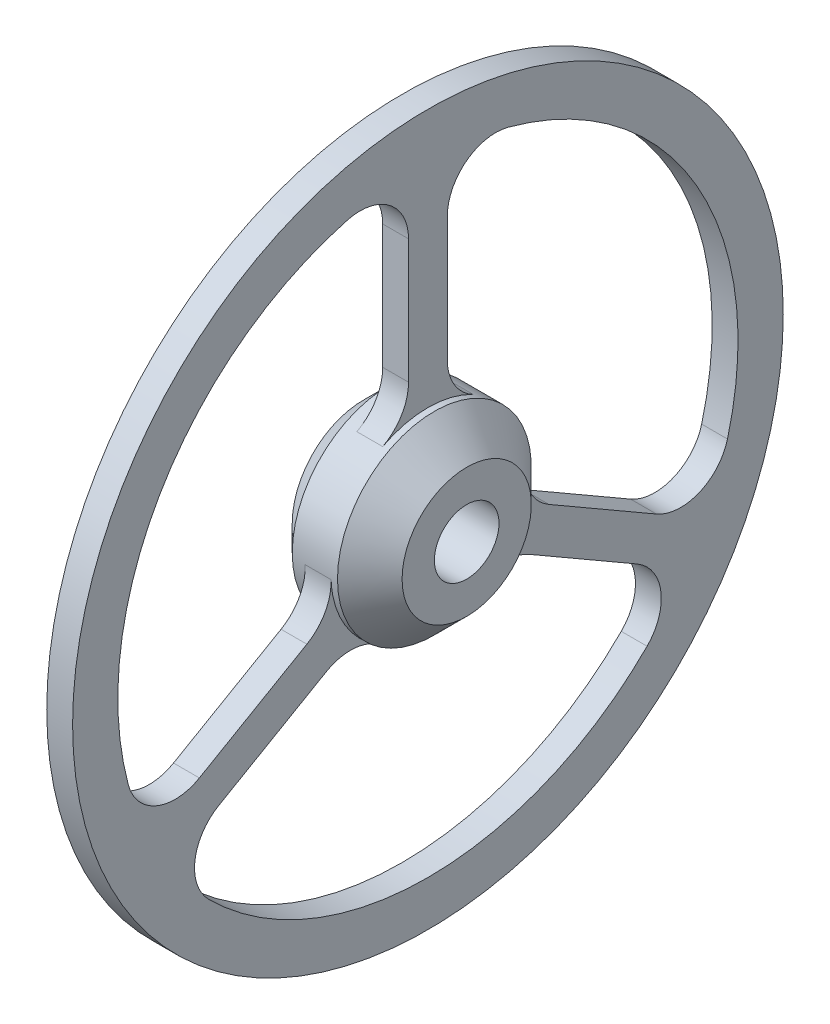
from build123d import *
from build123d.topology import SkipClean

# Parameters (mm, degrees)
SKETCH_1_R          = 55
EXTRUDE_1_DEPTH     = 4
SKETCH_4_R          = 15
SKETCH_3_R          = 15
SKETCH_7_R          = 15
SKETCH_6_R          = 15
SKETCH_9_R          = 5
CUT_EXTRUDE_1_DEPTH = 24
CHAMFER_1_SIZE      = 5
CHAMFER_2_SIZE      = 4


with BuildPart() as part:
    # 草图1 → 凸台-拉伸1 (new body)
    with BuildSketch(Plane(origin=(0, 0, 0), x_dir=(0, 0, -1), z_dir=(1, 0, 0))):
        Circle(SKETCH_1_R)
        with BuildLine():
            Line((-3, 39.115214431), (-3, 19.899748742))
            ThreePointArc((-3, 19.899748742), (-4.077383711, 16.026765396), (-7, 13.266499161))
            ThreePointArc((-7, 13.266499161), (-12.990381057, 7.5), (-14.989125293, -0.571071754))
            ThreePointArc((-14.989125293, -0.571071754), (-15.918277829, -4.482264824), (-18.73368794, -7.35179816))
            Line((-18.73368794, -7.35179816), (-35.374769372, -16.959531004))
            ThreePointArc((-35.374769372, -16.959531004), (-41.996474081, -17.39278273), (-46.370097033, -12.402181305))
            ThreePointArc((-46.370097033, -12.402181305), (-41.569219382, 24), (-12.444444444, 46.358772659))
            ThreePointArc((-12.444444444, 46.358772659), (-5.935645354, 45.066404788), (-3, 39.115214431))
        make_face(mode=Mode.SUBTRACT)
        with BuildLine():
            Line((3, 39.115214431), (3, 19.899748742))
            ThreePointArc((3, 19.899748742), (4.077383711, 16.026765396), (7, 13.266499161))
            ThreePointArc((7, 13.266499161), (12.990381057, 7.5), (14.989125293, -0.571071754))
            ThreePointArc((14.989125293, -0.571071754), (15.918277829, -4.482264824), (18.73368794, -7.35179816))
            Line((18.73368794, -7.35179816), (35.374769372, -16.959531004))
            ThreePointArc((35.374769372, -16.959531004), (41.996474081, -17.39278273), (46.370097033, -12.402181305))
            ThreePointArc((46.370097033, -12.402181305), (41.569219382, 24), (12.444444444, 46.358772659))
            ThreePointArc((12.444444444, 46.358772659), (5.935645354, 45.066404788), (3, 39.115214431))
        make_face(mode=Mode.SUBTRACT)
        with BuildLine():
            Line((32.374769372, -22.155683427), (15.73368794, -12.547950582))
            ThreePointArc((15.73368794, -12.547950582), (11.840894118, -11.544500572), (7.989125293, -12.695427407))
            ThreePointArc((7.989125293, -12.695427407), (0, -15), (-7.989125293, -12.695427407))
            ThreePointArc((-7.989125293, -12.695427407), (-11.840894118, -11.544500572), (-15.73368794, -12.547950582))
            Line((-15.73368794, -12.547950582), (-32.374769372, -22.155683427))
            ThreePointArc((-32.374769372, -22.155683427), (-36.060828727, -27.673622059), (-33.925652589, -33.956591354))
            ThreePointArc((-33.925652589, -33.956591354), (0, -48), (33.925652589, -33.956591354))
            ThreePointArc((33.925652589, -33.956591354), (36.060828727, -27.673622059), (32.374769372, -22.155683427))
        make_face(mode=Mode.SUBTRACT)
    extrude(amount=EXTRUDE_1_DEPTH)

    # 草图4 → 放样1 section 0
    with BuildSketch(Plane.ZY):
        Circle(SKETCH_4_R)
    # 草图3 → 放样1 section 1
    with BuildSketch(Plane.ZY.offset(6)):
        Circle(SKETCH_3_R)
    loft()

    # 草图7 → 放样2 section 0
    with SkipClean():  # the faces are left unmerged after this step: merging them gives an invalid solid
        with BuildSketch(Plane(origin=(10, 0, 0), x_dir=(0, 0, -1), z_dir=(1, 0, 0))):
            Circle(SKETCH_7_R)
        # 草图6 → 放样2 section 1
        with BuildSketch(Plane(origin=(4, 0, 0), x_dir=(0, 0, -1), z_dir=(1, 0, 0))):
            Circle(SKETCH_6_R)
        loft()

    # 草图9 → 切除-拉伸1 (cut, symmetric)
    with SkipClean():  # the faces are left unmerged after this step: merging them gives an invalid solid
        with BuildSketch(Plane.ZY.offset(6)):
            Circle(SKETCH_9_R)
        extrude(amount=CUT_EXTRUDE_1_DEPTH, both=True, mode=Mode.SUBTRACT)

    # 倒角1
    chamfer_1_edges = [part.edges().sort_by_distance(p)[0] for p in [
        (10, 0, 15),
    ]]
    chamfer(chamfer_1_edges, length=CHAMFER_1_SIZE)

    # 倒角2
    chamfer_2_edges = [part.edges().sort_by_distance(p)[0] for p in [
        (-6, 0, -15),
    ]]
    chamfer(chamfer_2_edges, length=CHAMFER_2_SIZE)


solid = part.part
